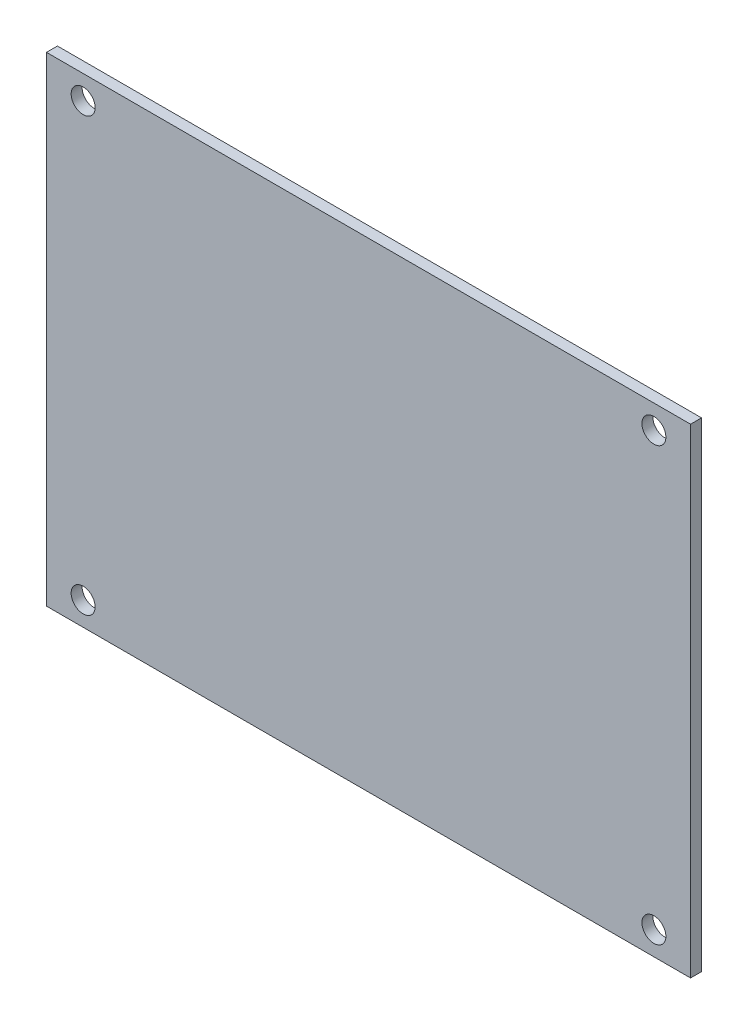
from build123d import *

# Parameters (mm, degrees)
SKETCH1_W           = 94
SKETCH1_H           = 70
SKETCH1_R           = 1.75
BOSS_EXTRUDE1_DEPTH = 1.6


with BuildPart() as part:
    # Sketch1 → Boss-Extrude1 (new body)
    with BuildSketch(Plane.XY):
        Rectangle(SKETCH1_W, SKETCH1_H)
        with Locations((-41.65, 31.55)):
            Circle(SKETCH1_R, mode=Mode.SUBTRACT)
        with Locations(Location((41.65, 31.55, 0), (0, 0, 180))):
            Circle(SKETCH1_R, mode=Mode.SUBTRACT)
        with Locations((41.65, -31.55)):
            Circle(SKETCH1_R, mode=Mode.SUBTRACT)
        with Locations(Location((-41.65, -31.55, 0), (0, 0, 180))):
            Circle(SKETCH1_R, mode=Mode.SUBTRACT)
    extrude(amount=BOSS_EXTRUDE1_DEPTH)


solid = part.part
